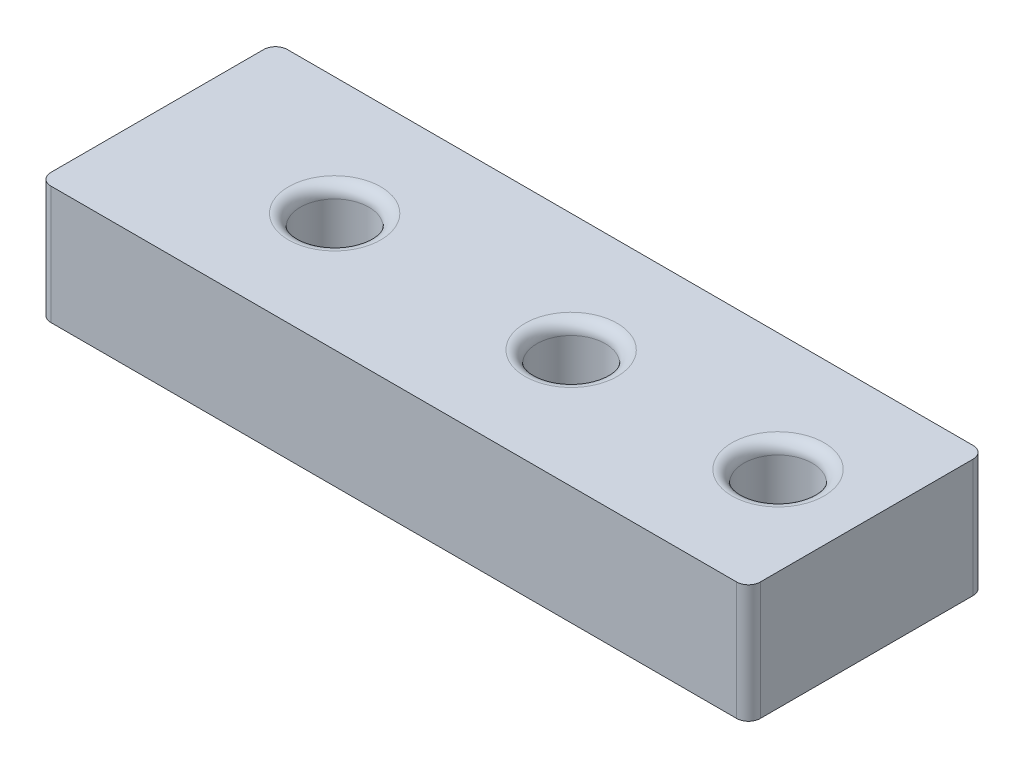
from build123d import *

# Parameters (mm, degrees)
SKETCH1_W               = 76.2
SKETCH1_H               = 25.4
BOSS_EXTRUDE1_DEPTH     = 12.7
F_1_4_CLEARANCE_HOLE1_D = 7.366
FILLET1_R               = 1.27


with BuildPart() as part:
    # Sketch1 → Boss-Extrude1 (new body)
    with BuildSketch(Plane(origin=(0, 0, 0), x_dir=(1, 0, 0), z_dir=(0, 1, 0))):
        Rectangle(SKETCH1_W, SKETCH1_H)
    extrude(amount=BOSS_EXTRUDE1_DEPTH)

    # 1/4 Clearance Hole1 (through all)
    with Locations(Plane(origin=(0, 12.7, 0), x_dir=(1, 0, 0), z_dir=(0, 1, 0))):
        with Locations((28.575, 0), (-19.05, 0), (6.35, 0)):
            Hole(F_1_4_CLEARANCE_HOLE1_D / 2)

    # Fillet1
    fillet1_edges = [part.edges().sort_by_distance(p)[0] for p in [
        (10.033, 12.7, 0),
        (10.033, 0, 0),
        (-15.367, 12.7, 0),
        (-15.367, 0, 0),
        (32.258, 12.7, 0),
        (32.258, 0, 0),
        (38.1, 6.35, 12.7),
        (-38.1, 6.35, 12.7),
        (-38.1, 6.35, -12.7),
        (38.1, 6.35, -12.7),
    ]]
    fillet(fillet1_edges, radius=FILLET1_R)


solid = part.part
